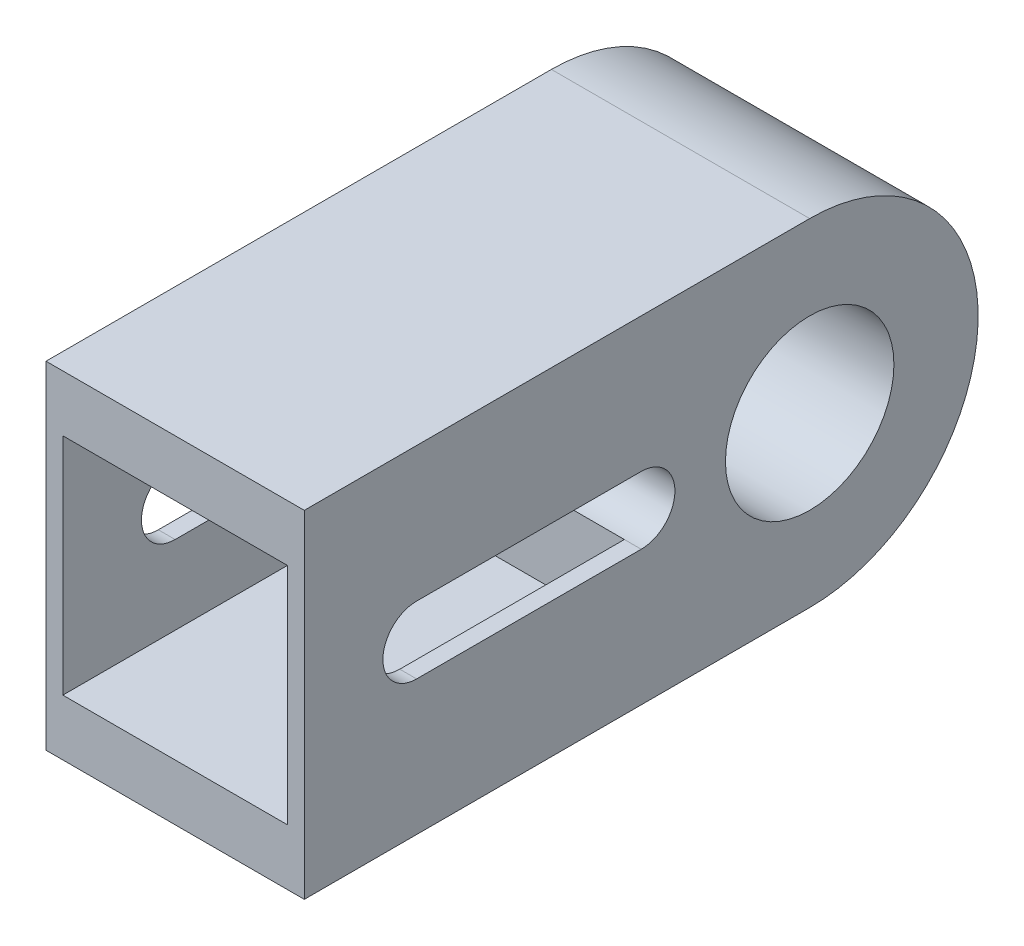
from build123d import *

# Parameters (mm, degrees)
BOSS_EXTRUDE1_DEPTH = 23
CUT_EXTRUDE1_DEPTH  = 45.52248299
SKETCH3_R           = 7.5
CUT_EXTRUDE2_DEPTH  = 45.52248299
SKETCH4_W           = 20
SKETCH4_H           = 20
CUT_EXTRUDE3_DEPTH  = 30


with BuildPart() as part:
    # Sketch1 → Boss-Extrude1 (new body)
    with BuildSketch(Plane(origin=(0, 0, 0), x_dir=(0, 0, -1), z_dir=(1, 0, 0))):
        with BuildLine():
            Line((-24.953580902, 15), (20.046419098, 15))
            ThreePointArc((20.046419098, 15), (35.046419098, 0), (20.046419098, -15))
            Line((20.046419098, -15), (-24.953580902, -15))
            Line((-24.953580902, -15), (-24.953580902, 15))
        make_face()
    extrude(amount=-BOSS_EXTRUDE1_DEPTH)

    # Sketch2 → Cut-Extrude1 (cut, through all)
    with BuildSketch(Plane(origin=(0, 0, 0), x_dir=(0, 0, -1), z_dir=(1, 0, 0))):
        with BuildLine():
            Line((-14.953580902, 3), (5.046419098, 3))
            ThreePointArc((5.046419098, 3), (8.046419098, 0), (5.046419098, -3))
            Line((5.046419098, -3), (-14.953580902, -3))
            ThreePointArc((-14.953580902, -3), (-17.953580902, 0), (-14.953580902, 3))
        make_face()
    extrude(amount=-CUT_EXTRUDE1_DEPTH, mode=Mode.SUBTRACT)

    # Sketch3 → Cut-Extrude2 (cut, through all)
    with BuildSketch(Plane(origin=(0, 0, 0), x_dir=(0, 0, -1), z_dir=(1, 0, 0))):
        with Locations((20.046419098, 0)):
            Circle(SKETCH3_R)
    extrude(amount=-CUT_EXTRUDE2_DEPTH, mode=Mode.SUBTRACT)

    # Sketch4 → Cut-Extrude3 (cut)
    with BuildSketch(Plane.XY.offset(24.953580902)):
        with Locations((-11.5, 0)):
            Rectangle(SKETCH4_W, SKETCH4_H)
    extrude(amount=-CUT_EXTRUDE3_DEPTH, mode=Mode.SUBTRACT)


solid = part.part
